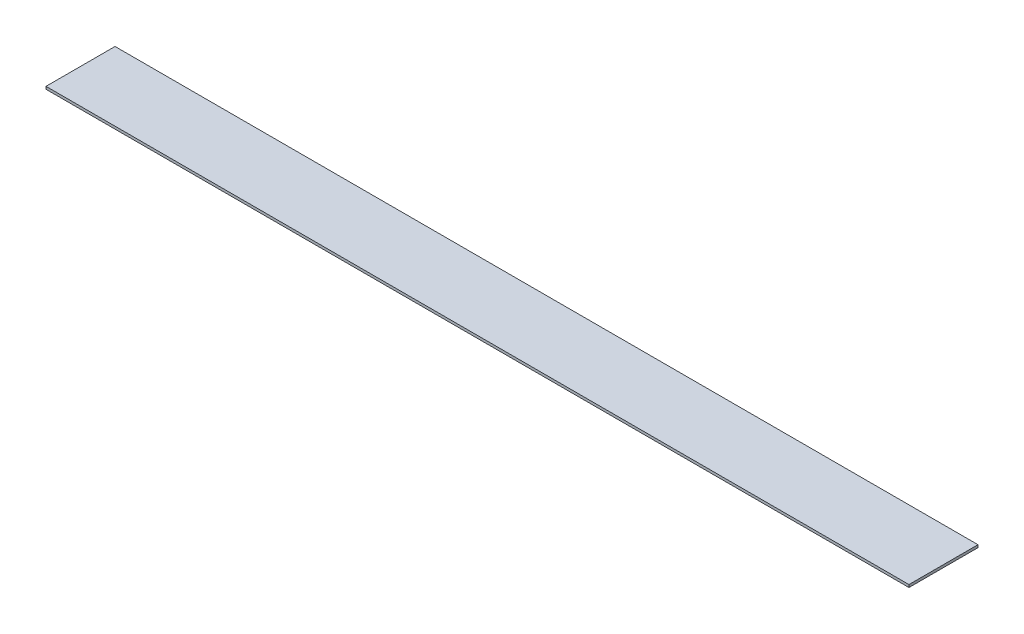
from build123d import *

# Parameters (mm, degrees)
SKETCH_1_W      = 500
SKETCH_1_H      = 40
EXTRUDE_1_DEPTH = 1.5


with BuildPart() as part:
    # Эскиз1 → Бобышка-Вытянуть1 (new body)
    with BuildSketch(Plane(origin=(0, 0, 0), x_dir=(1, 0, 0), z_dir=(0, 1, 0))):
        Rectangle(SKETCH_1_W, SKETCH_1_H)
    extrude(amount=EXTRUDE_1_DEPTH)


solid = part.part
